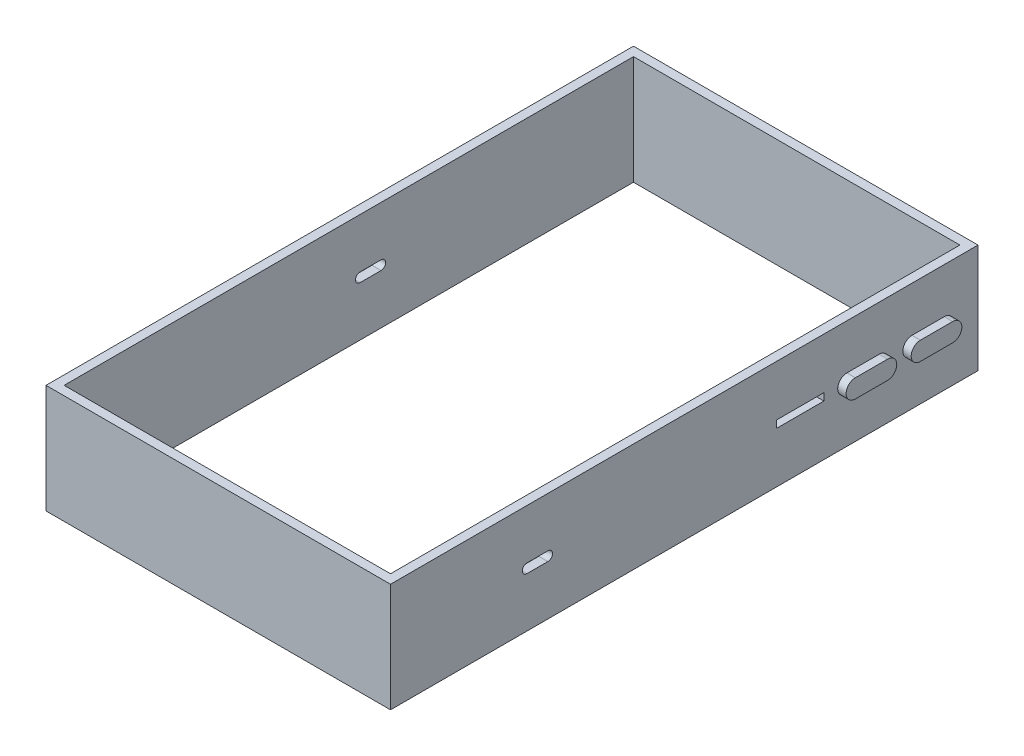
from build123d import *

# Parameters (mm, degrees)
SKETCH1_W           = 94.999999992
SKETCH1_H           = 162.000000104
BOSS_EXTRUDE1_DEPTH = 30
SKETCH2_W           = 90.000000086
SKETCH2_H           = 156.999999944
CUT_EXTRUDE1_DEPTH  = 30
SKETCH3_W           = 13
SKETCH3_H           = 2
BOSS_EXTRUDE2_DEPTH = 2.314
SKETCH4_W           = 13
SKETCH4_H           = 2
CUT_EXTRUDE2_DEPTH  = 6.632
CUT_EXTRUDE3_START  = -6.632
CUT_EXTRUDE3_DEPTH  = 6.632
CUT_EXTRUDE4_DEPTH  = 6.632
BOSS_EXTRUDE3_DEPTH = 2.54


with BuildPart() as part:
    # Sketch1 → Boss-Extrude1 (new body)
    with BuildSketch(Plane(origin=(0, 0, 0), x_dir=(1, 0, 0), z_dir=(0, 1, 0))):
        Rectangle(SKETCH1_W, SKETCH1_H)
    extrude(amount=BOSS_EXTRUDE1_DEPTH)

    # Sketch2 → Cut-Extrude1 (cut)
    with BuildSketch(Plane(origin=(0, 30, 0), x_dir=(1, 0, 0), z_dir=(0, 1, 0))):
        Rectangle(SKETCH2_W, SKETCH2_H)
    extrude(amount=-CUT_EXTRUDE1_DEPTH, mode=Mode.SUBTRACT)

    # Sketch3 → Boss-Extrude2 (add)
    with BuildSketch(Plane(origin=(47.499999996, 0, 0), x_dir=(0, 0, -1), z_dir=(1, 0, 0))):
        with BuildLine():
            Line((71.695000052, 12.46), (62.805000052, 12.46))
            ThreePointArc((62.805000052, 12.46), (60.265000052, 15), (62.805000052, 17.54))
            Line((62.805000052, 17.54), (71.695000052, 17.54))
            ThreePointArc((71.695000052, 17.54), (74.235000052, 15), (71.695000052, 12.46))
        make_face()
        with BuildLine():
            Line((53.744999952, 12.46), (44.854999952, 12.46))
            ThreePointArc((44.854999952, 12.46), (42.314999952, 15), (44.854999952, 17.54))
            Line((44.854999952, 17.54), (53.744999952, 17.54))
            ThreePointArc((53.744999952, 17.54), (56.284999952, 15), (53.744999952, 12.46))
        make_face()
        with Locations((32.000000052, 15)):
            Rectangle(SKETCH3_W, SKETCH3_H)
        with BuildLine():
            Line((-37.609999928, 13.72000002), (-43.389999968, 13.72000002))
            ThreePointArc((-43.389999968, 13.72000002), (-44.669999948, 15), (-43.389999968, 16.27999998))
            Line((-43.389999968, 16.27999998), (-37.609999928, 16.27999998))
            ThreePointArc((-37.609999928, 16.27999998), (-36.329999948, 15), (-37.609999928, 13.72000002))
        make_face()
    extrude(amount=BOSS_EXTRUDE2_DEPTH)

    # Sketch4 → Cut-Extrude2 (cut)
    with BuildSketch(Plane(origin=(49.813999996, 0, 0), x_dir=(0, 0, -1), z_dir=(1, 0, 0))):
        with Locations((32.000000052, 15)):
            Rectangle(SKETCH4_W, SKETCH4_H)
    extrude(amount=-CUT_EXTRUDE2_DEPTH, mode=Mode.SUBTRACT)

    # Sketch5 → Cut-Extrude3 (cut)
    with BuildSketch(Plane(origin=(49.813999996, 0, 0), x_dir=(0, 0, -1), z_dir=(1, 0, 0)).offset(CUT_EXTRUDE3_START)):
        with BuildLine():
            Line((-43.389999968, 16.27999998), (-37.609999928, 16.27999998))
            ThreePointArc((-37.609999928, 16.27999998), (-36.704903262, 15.905096666), (-36.329999948, 15))
            ThreePointArc((-36.329999948, 15), (-36.704903262, 14.094903334), (-37.609999928, 13.72000002))
            Line((-37.609999928, 13.72000002), (-43.389999968, 13.72000002))
            ThreePointArc((-43.389999968, 13.72000002), (-44.295096634, 14.094903334), (-44.669999948, 15))
            ThreePointArc((-44.669999948, 15), (-44.295096634, 15.905096666), (-43.389999968, 16.27999998))
        make_face()
    extrude(amount=CUT_EXTRUDE3_DEPTH, mode=Mode.SUBTRACT)

    # Sketch6 → Cut-Extrude4 (cut)
    with BuildSketch(Plane.ZY.offset(47.499999996)):
        with BuildLine():
            Line((-8.890000094, 16.28), (-3.11000001, 16.28))
            ThreePointArc((-3.11000001, 16.28), (-1.83000001, 15), (-3.11000001, 13.72))
            Line((-3.11000001, 13.72), (-8.890000094, 13.72))
            ThreePointArc((-8.890000094, 13.72), (-10.170000094, 15), (-8.890000094, 16.28))
        make_face()
    extrude(amount=-CUT_EXTRUDE4_DEPTH, mode=Mode.SUBTRACT)

    # Sketch9 → Boss-Extrude3 (add)
    with BuildSketch(Plane.ZY.offset(47.499999996)):
        with BuildLine():
            Line((-59.880000052, 9.717636473), (-67.500000052, 9.717636473))
            ThreePointArc((-67.500000052, 9.717636473), (-70.040000052, 12.257636473), (-67.500000052, 14.797636473))
            Line((-67.500000052, 14.797636473), (-59.880000052, 14.797636473))
            ThreePointArc((-59.880000052, 14.797636473), (-57.340000052, 12.257636473), (-59.880000052, 9.717636473))
        make_face()
    extrude(amount=BOSS_EXTRUDE3_DEPTH)


solid = part.part
